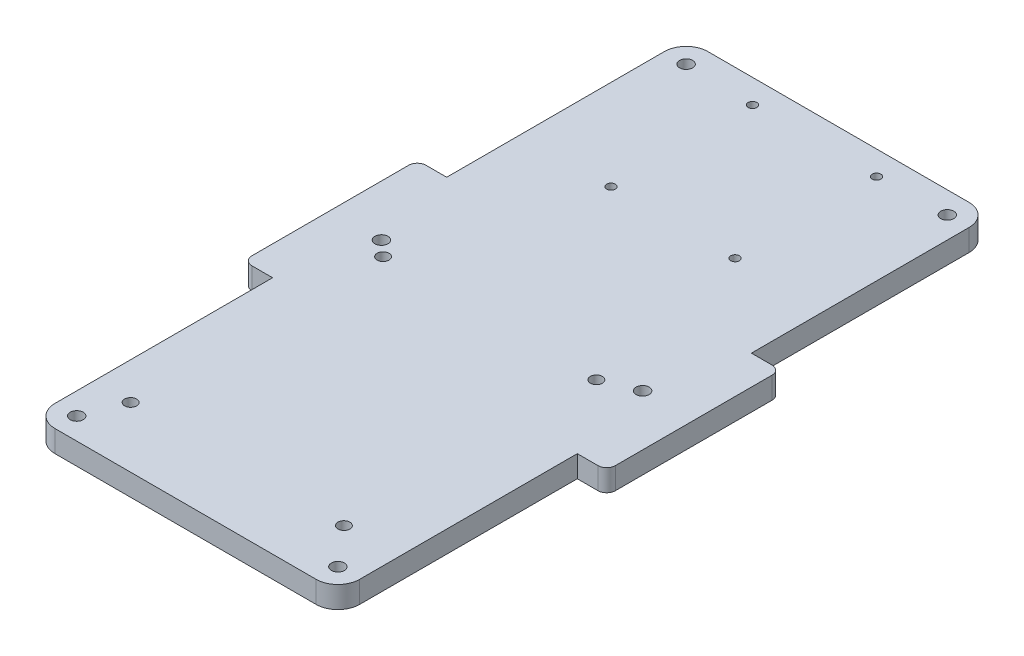
from build123d import *

# Parameters (mm, degrees)
EXTRUDE_1_DEPTH     = 5
SKETCH_3_R          = 1.5
SKETCH_3_R_2        = 1.375
SKETCH_3_R_3        = 1
CUT_EXTRUDE_1_DEPTH = 114.61053585


with BuildPart() as part:
    # 草图1 → 凸台-拉伸1 (new body)
    with BuildSketch(Plane(origin=(0, 0, 0), x_dir=(1, 0, 0), z_dir=(0, 1, 0))):
        with BuildLine():
            Line((-25.929831279, 46.15942029), (34.070168721, 46.15942029))
            ThreePointArc((34.070168721, 46.15942029), (37.605702627, 44.694954196), (39.070168721, 41.15942029))
            Line((39.070168721, 41.15942029), (39.070168721, -8.84057971))
            Line((39.070168721, -8.84057971), (43.820168721, -8.84057971))
            ThreePointArc((43.820168721, -8.84057971), (45.234382283, -9.426366148), (45.820168721, -10.84057971))
            Line((45.820168721, -10.84057971), (45.820168721, -46.84057971))
            ThreePointArc((45.820168721, -46.84057971), (45.234382283, -48.254793273), (43.820168721, -48.84057971))
            Line((43.820168721, -48.84057971), (39.070168721, -48.84057971))
            Line((39.070168721, -48.84057971), (39.070168721, -98.84057971))
            ThreePointArc((39.070168721, -98.84057971), (37.605702627, -102.376113616), (34.070168721, -103.84057971))
            Line((34.070168721, -103.84057971), (-25.929831279, -103.84057971))
            ThreePointArc((-25.929831279, -103.84057971), (-29.465365185, -102.376113616), (-30.929831279, -98.84057971))
            Line((-30.929831279, -98.84057971), (-30.929831279, -48.84057971))
            Line((-30.929831279, -48.84057971), (-35.679831279, -48.84057971))
            ThreePointArc((-35.679831279, -48.84057971), (-37.094044841, -48.254793273), (-37.679831279, -46.84057971))
            Line((-37.679831279, -46.84057971), (-37.679831279, -10.84057971))
            ThreePointArc((-37.679831279, -10.84057971), (-37.094044841, -9.426366148), (-35.679831279, -8.84057971))
            Line((-35.679831279, -8.84057971), (-30.929831279, -8.84057971))
            Line((-30.929831279, -8.84057971), (-30.929831279, 41.15942029))
            ThreePointArc((-30.929831279, 41.15942029), (-29.465365185, 44.694954196), (-25.929831279, 46.15942029))
        make_face()
    extrude(amount=EXTRUDE_1_DEPTH)

    # 草图3 → 切除-拉伸1 (cut, through all)
    with BuildSketch(Plane(origin=(0, 5, 0), x_dir=(1, 0, 0), z_dir=(0, 1, 0))):
        with Locations(Location((34.070168721, 41.15942029, 0), (0, 0, 270))):
            Circle(SKETCH_3_R)
        with Locations(Location((-25.929831279, 41.15942029, 0), (0, 0, 270))):
            Circle(SKETCH_3_R)
        with Locations(Location((-25.929831279, -98.84057971, 0), (0, 0, 270))):
            Circle(SKETCH_3_R)
        with Locations(Location((34.070168721, -98.84057971, 0), (0, 0, 270))):
            Circle(SKETCH_3_R)
        with Locations(Location((34.070168721, -28.84057971, 0), (0, 0, 270))):
            Circle(SKETCH_3_R)
        with Locations(Location((-25.929831279, -28.84057971, 0), (0, 0, 270))):
            Circle(SKETCH_3_R)
        with Locations(Location((26.570168721, -31.962567588, 0), (0, 0, 270))):
            Circle(SKETCH_3_R_2)
        with Locations(Location((-22.429831279, -31.962567588, 0), (0, 0, 270))):
            Circle(SKETCH_3_R_2)
        with Locations(Location((26.570168721, -89.962567588, 0), (0, 0, 270))):
            Circle(SKETCH_3_R_2)
        with Locations(Location((-22.429831279, -89.962567588, 0), (0, 0, 270))):
            Circle(SKETCH_3_R_2)
        with Locations(Location((-10.179831279, 40.658771251, 0), (0, 0, 270))):
            Circle(SKETCH_3_R_3)
        with Locations(Location((18.320168721, 40.658771251, 0), (0, 0, 90))):
            Circle(SKETCH_3_R_3)
        with Locations(Location((-10.179831279, 8.158771251, 0), (0, 0, 90))):
            Circle(SKETCH_3_R_3)
        with Locations(Location((18.320168721, 8.158771251, 0), (0, 0, 270))):
            Circle(SKETCH_3_R_3)
    extrude(amount=-CUT_EXTRUDE_1_DEPTH, mode=Mode.SUBTRACT)


solid = part.part
